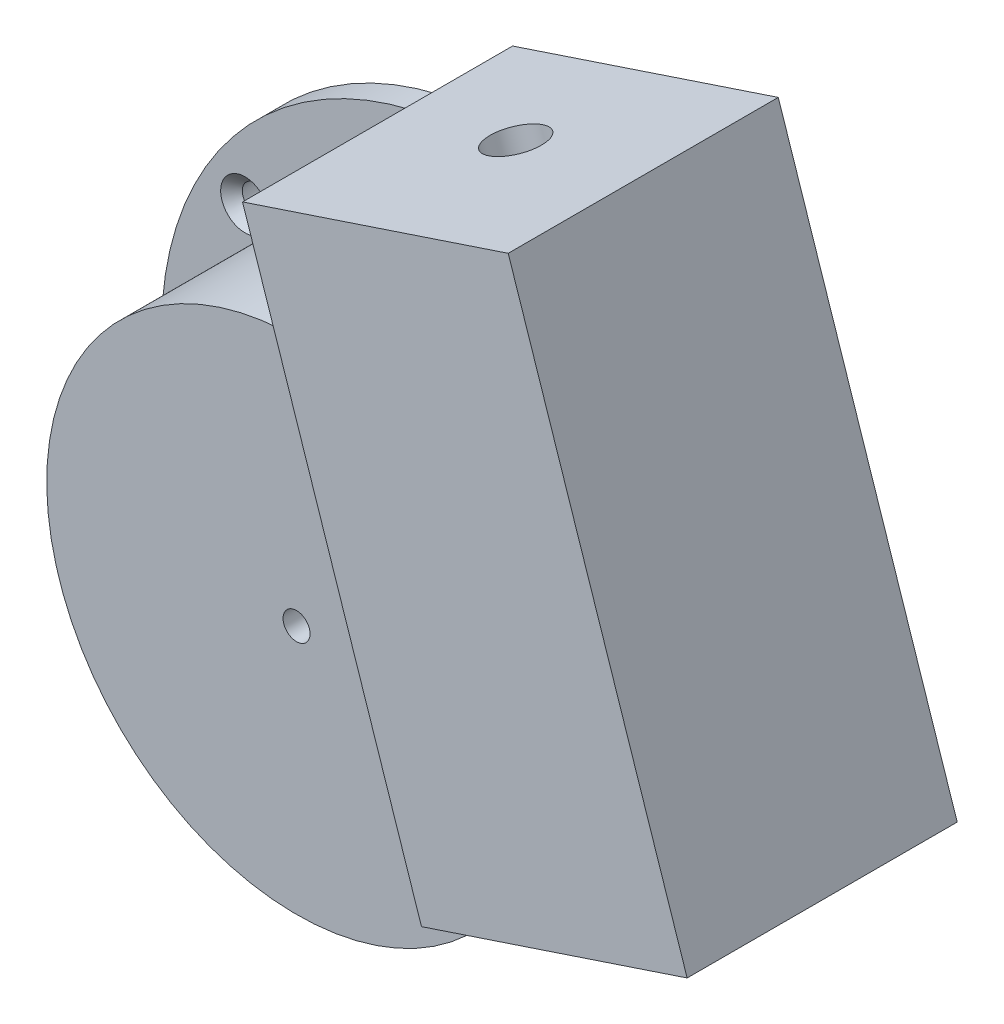
from build123d import *
from build123d.topology import SkipClean

# Parameters (mm, degrees)
ESTRUSIONE_ESTRUSIONE1_DEPTH             = 2
ESTRUSIONE_ESTRUSIONE3_DEPTH             = 12
ESTRUSIONE_ESTRUSIONE4_DEPTH             = 12
SCHIZZO7_R                               = 17
TAGLIO_ESTRUSIONE1_DEPTH                 = 12
ESTRUSIONE_ESTRUSIONE5_DEPTH             = 4
ESTRUSIONE_ESTRUSIONE6_DEPTH             = 2
SCHIZZO12_R                              = 18.5
ESTRUSIONE_ESTRUSIONE7_DEPTH             = 2
SCHIZZO13_R                              = 1
TAGLIO_ESTRUSIONE2_DEPTH                 = 2
SCHIZZO14_R                              = 1.9999999999999996
TAGLIO_ESTRUSIONE3_DEPTH                 = 2
FORO_SVASATO_PER_VITE_M1_6_1_D           = 2
FORO_SVASATO_PER_VITE_M1_6_1_CSINK_D     = 3.6
FORO_SVASATO_PER_VITE_M1_6_1_CSINK_ANGLE = 90


with BuildPart() as part:
    # Schizzo1 → Estrusione-Estrusione1 (new body)
    with BuildSketch(Plane.XY):
        with BuildLine():
            Line((1.7521545270351044, 23.935955266364257), (0, 29.20537764983825))
            Line((0, 29.20537764983825), (19.6753238609994, 35.74769012075539))
            Line((19.6753238609994, 35.74769012075539), (32.92722566640575, -4.1060253589917055))
            Line((32.92722566640575, -4.1060253589917055), (22.80756216564372, -7.470950947523162))
            ThreePointArc((22.80756216564372, -7.470950947523162), (-19.934727499721227, -13.364379503435943), (1.7521545270351044, 23.935955266364257))
        make_face()
        with BuildLine():
            Line((4.2368221069293845, 16.46357611317282), (13.251901805406366, -10.648337829908835))
            ThreePointArc((13.251901805406366, -10.648337829908835), (-16.131578826473948, -5.3639691055465315), (4.2368221069293845, 16.46357611317282))
        make_face(mode=Mode.SUBTRACT)
    extrude(amount=ESTRUSIONE_ESTRUSIONE1_DEPTH)

    # Schizzo3 → Estrusione-Estrusione3 (add)
    with SkipClean():  # the faces are left unmerged after this step: merging them gives an invalid solid
        with BuildSketch(Plane.XY.offset(2)):
            with BuildLine():
                Line((13.25190180540636, -10.64833782990884), (15.661571428601047, -9.84708994509684))
                ThreePointArc((15.661571428601047, -9.84708994509684), (-17.00666852177596, -7.281704868396873), (3.6828047807986604, 18.12972556180944))
                Line((3.6828047807986604, 18.12972556180944), (4.236822106929399, 16.463576113172813))
                ThreePointArc((4.236822106929399, 16.463576113172813), (-16.131578826473945, -5.363969105546531), (13.25190180540636, -10.64833782990884))
            make_face()
        extrude(amount=ESTRUSIONE_ESTRUSIONE3_DEPTH)

    # Schizzo5 → Estrusione-Estrusione4 (add)
    with SkipClean():  # the faces are left unmerged after this step: merging them gives an invalid solid
        with BuildSketch(Plane.XY.offset(2)):
            Polygon((4.2368221069293845, 16.46357611317282), (9.20072700457541, 7.873738581138368), (2.5288879920024105, 27.938600035611493), (18.408546246772644, 33.21880212875297), (30.39833767440335, -2.8392477447649496), (12.62084661651854, -8.75050502679426), (13.251901805406368, -10.648337829908835), (32.92722566640575, -4.1060253589917055), (19.6753238609994, 35.74769012075539), (0, 29.20537764983825), align=None)
        extrude(amount=ESTRUSIONE_ESTRUSIONE4_DEPTH)

    # Schizzo7 → Taglio-Estrusione1 (cut, symmetric)
    with SkipClean():  # the faces are left unmerged after this step: merging them gives an invalid solid
        with BuildSketch(Plane.XY.offset(2)):
            with Locations(Location((0, 0, 0), (0, 0, 67.114761627))):
                Circle(SCHIZZO7_R)
        extrude(amount=TAGLIO_ESTRUSIONE1_DEPTH, both=True, mode=Mode.SUBTRACT)

    # Schizzo10 → Estrusione-Estrusione5 (add)
    with SkipClean():  # the faces are left unmerged after this step: merging them gives an invalid solid
        with BuildSketch(Plane.XY.offset(14)):
            Polygon((32.92722566640575, -4.1060253589917055), (13.251901805406353, -10.648337829908842), (0, 29.20537764983825), (19.6753238609994, 35.74769012075539), align=None)
            Polygon((30.39833767440335, -2.8392477447649496), (14.51867941963312, -8.119449837906433), (2.5288879920024105, 27.938600035611493), (18.408546246772644, 33.21880212875297), align=None, mode=Mode.SUBTRACT)
        extrude(amount=ESTRUSIONE_ESTRUSIONE5_DEPTH)

    # Schizzo11 → Estrusione-Estrusione6 (add)
    with SkipClean():  # the faces are left unmerged after this step: merging them gives an invalid solid
        with BuildSketch(Plane.XY.offset(18.000000000000004)):
            Polygon((32.92722566640575, -4.1060253589917055), (13.25190180540637, -10.648337829908844), (0, 29.20537764983825), (19.6753238609994, 35.74769012075539), align=None)
        extrude(amount=ESTRUSIONE_ESTRUSIONE6_DEPTH)

    # Schizzo12 → Estrusione-Estrusione7 (add)
    with SkipClean():  # the faces are left unmerged after this step: merging them gives an invalid solid
        with BuildSketch(Plane.XY.offset(14)):
            Circle(SCHIZZO12_R)
        extrude(amount=ESTRUSIONE_ESTRUSIONE7_DEPTH)

    # Schizzo13 → Taglio-Estrusione2 (cut)
    with SkipClean():  # the faces are left unmerged after this step: merging them gives an invalid solid
        with BuildSketch(Plane.XY.offset(16)):
            Circle(SCHIZZO13_R)
        extrude(amount=-TAGLIO_ESTRUSIONE2_DEPTH, mode=Mode.SUBTRACT)

    # Schizzo14 → Taglio-Estrusione3 (cut)
    with SkipClean():  # the faces are left unmerged after this step: merging them gives an invalid solid
        with BuildSketch(Plane(origin=(-8.744361956167872, 26.29775850820628, 0), x_dir=(0.9489164015572907, 0.31552759444391354, 0), z_dir=(-0.31552759444391354, 0.9489164015572907, 0))):
            with Locations(Location((18.94410254301622, -9.000000000000004, 0), (0, 0, 180))):
                Circle(SCHIZZO14_R)
        extrude(amount=-TAGLIO_ESTRUSIONE3_DEPTH, mode=Mode.SUBTRACT)

    # Foro svasato per Vite M1.6-1 (through all)
    with Locations(Plane(origin=(0.714435954, 20.987843655, 2), x_dir=(1, 0, 0), z_dir=(0, 0, 1))):
        with Locations((0, 0), (-18.533223752, -9.875202142), (-11.827077467, -38.806631453), (17.104351844, -32.100485168)):
            CounterSinkHole(FORO_SVASATO_PER_VITE_M1_6_1_D / 2, FORO_SVASATO_PER_VITE_M1_6_1_CSINK_D / 2, counter_sink_angle=FORO_SVASATO_PER_VITE_M1_6_1_CSINK_ANGLE)


solid = part.part
